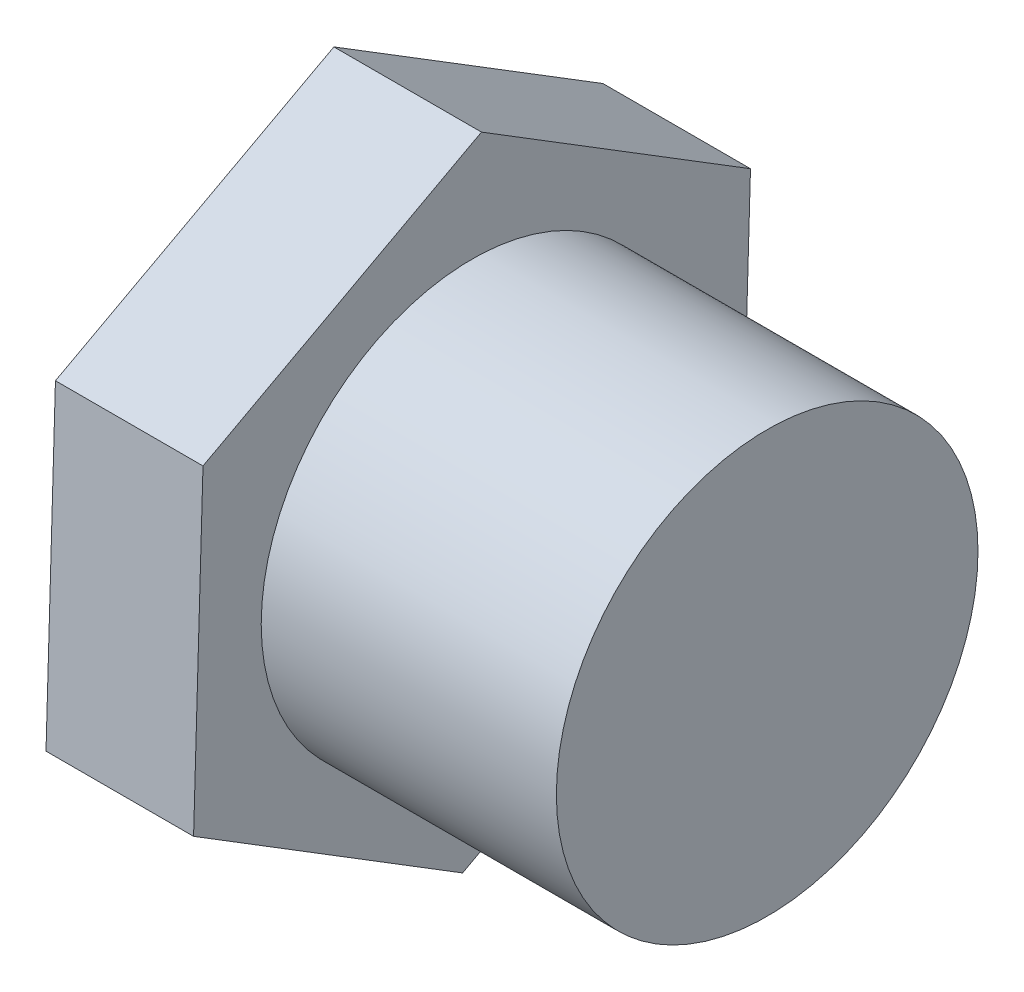
from build123d import *

# Parameters (mm, degrees)
CROQUIS1_R              = 10
SALIENTE_EXTRUIR1_DEPTH = 14
CROQUIS2_R              = 15
SALIENTE_EXTRUIR2_DEPTH = 7
CORTAR_EXTRUIR1_DEPTH   = 30.849623113


with BuildPart() as part:
    # Croquis1 → Saliente-Extruir1 (new body)
    with BuildSketch(Plane(origin=(0, 0, 0), x_dir=(0, 0, -1), z_dir=(1, 0, 0))):
        Circle(CROQUIS1_R)
    extrude(amount=SALIENTE_EXTRUIR1_DEPTH)

    # Croquis2 → Saliente-Extruir2 (add)
    with BuildSketch(Plane.ZY):
        Circle(CROQUIS2_R)
    extrude(amount=SALIENTE_EXTRUIR2_DEPTH)

    # Croquis5 → Cortar-Extruir1 (cut, through all)
    with BuildSketch(Plane.ZY.offset(7)):
        with BuildLine():
            Line((-13.208306062, 7.109194819), (-0.447409717, 14.993326))
            ThreePointArc((-0.447409717, 14.993326), (-7.884131181, 12.760896345), (-13.208306062, 7.109194819))
        make_face()
        with BuildLine():
            Line((-12.760896345, -7.884131181), (-13.208306062, 7.109194819))
            ThreePointArc((-13.208306062, 7.109194819), (-14.993326, -0.447409717), (-12.760896345, -7.884131181))
        make_face()
        with BuildLine():
            Line((0.447409717, -14.993326), (-12.760896345, -7.884131181))
            ThreePointArc((-12.760896345, -7.884131181), (-7.109194819, -13.208306062), (0.447409717, -14.993326))
        make_face()
        with BuildLine():
            ThreePointArc((0.447409717, -14.993326), (7.884131181, -12.760896345), (13.208306062, -7.109194819))
            Line((13.208306062, -7.109194819), (0.447409717, -14.993326))
        make_face()
        with BuildLine():
            ThreePointArc((15, 0), (14.429370138, 4.097960153), (12.760896345, 7.884131181))
            Line((12.760896345, 7.884131181), (13.208306062, -7.109194819))
            ThreePointArc((13.208306062, -7.109194819), (14.545181177, -3.665747473), (15, 0))
        make_face()
        with BuildLine():
            ThreePointArc((12.760896345, 7.884131181), (7.109194819, 13.208306062), (-0.447409717, 14.993326))
            Line((-0.447409717, 14.993326), (12.760896345, 7.884131181))
        make_face()
    extrude(amount=-CORTAR_EXTRUIR1_DEPTH, mode=Mode.SUBTRACT)


solid = part.part
